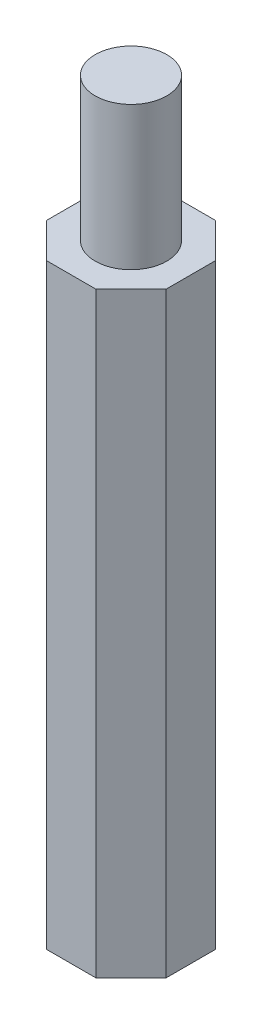
from build123d import *

# Parameters (mm, degrees)
EXTRUSION1_DEPTH        = 12.5
ESQUISSE2_R             = 1.5
EXTRUSION2_DEPTH        = 6
ESQUISSE3_R             = 1.5
ENL_V_MAT_EXTRU_1_DEPTH = 7


with BuildPart() as part:
    # Esquisse1 → Extrusion1 (new, symmetric)
    with BuildSketch(Plane(origin=(0, 0, 0), x_dir=(1, 0, 0), z_dir=(0, 1, 0))):
        Polygon((-1.035533906, 2.5), (1.035533906, 2.5), (2.5, 1.035533906), (2.5, -1.035533906), (1.035533906, -2.5), (-1.035533906, -2.5), (-2.5, -1.035533906), (-2.5, 1.035533906), align=None)
    extrude(amount=EXTRUSION1_DEPTH, both=True)

    # Esquisse2 → Extrusion2 (add)
    with BuildSketch(Plane(origin=(0, 12.5, 0), x_dir=(1, 0, 0), z_dir=(0, 1, 0))):
        with Locations(Location((0, 0, 0), (0, 0, 270))):
            Circle(ESQUISSE2_R)
    extrude(amount=EXTRUSION2_DEPTH)

    # Esquisse3 → Enlèv. mat.-Extru.1 (cut)
    with BuildSketch(Plane.XZ.offset(12.5)):
        with Locations(Location((0, 0, 0), (0, 0, 90))):
            Circle(ESQUISSE3_R)
    extrude(amount=-ENL_V_MAT_EXTRU_1_DEPTH, mode=Mode.SUBTRACT)


solid = part.part
